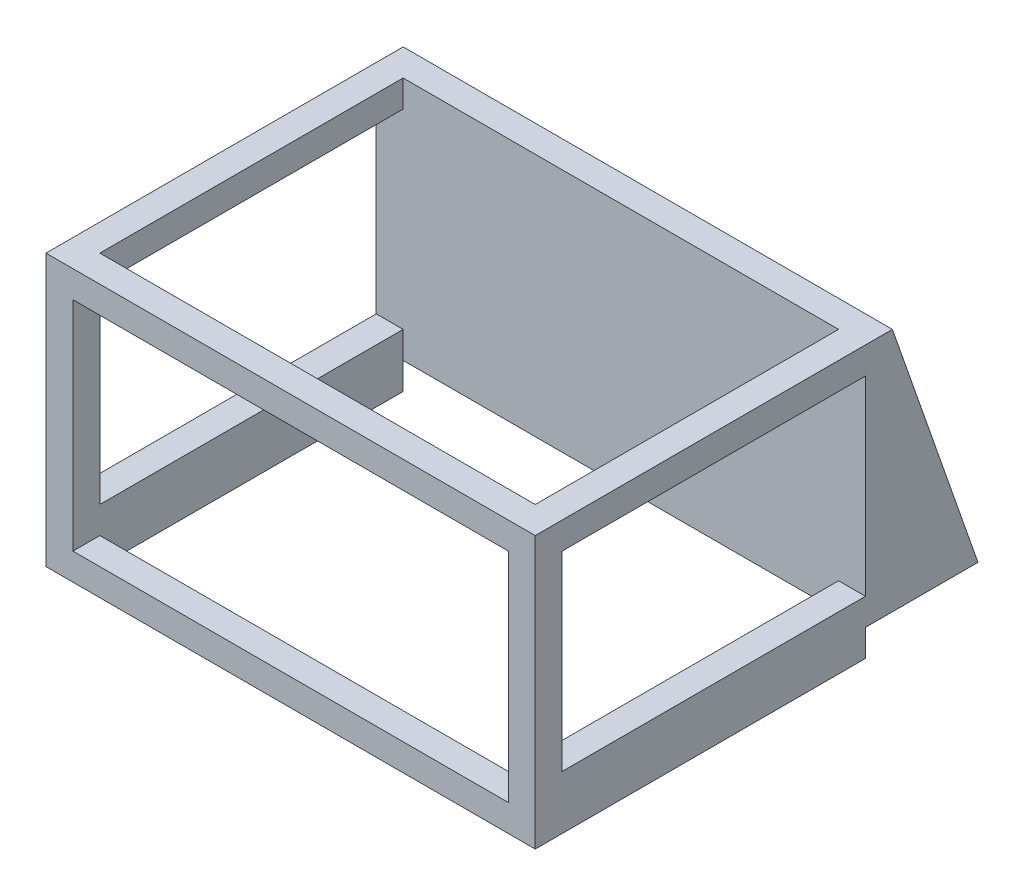
from build123d import *

# Parameters (mm, degrees)
ESQUISSE1_W             = 400
ESQUISSE1_H             = 222
BOSS_EXTRU_1_DEPTH      = 292
ESQUISSE2_W             = 356
ESQUISSE2_H             = 270
ENL_V_MAT_EXTRU_1_DEPTH = 428.684801456
ESQUISSE8_W             = 270
ESQUISSE8_H             = 156
ENL_V_MAT_EXTRU_2_DEPTH = 513.128650853
ESQUISSE9_W             = 356
ESQUISSE9_H             = 178
ENL_V_MAT_EXTRU_3_DEPTH = 389.126325339
ESQUISSE10_W            = 22
ESQUISSE10_H            = 22
ENL_V_MAT_EXTRU_4_DEPTH = 400
ESQUISSE11_W            = 22
ESQUISSE11_H            = 200
BOSS_EXTRU_2_DEPTH      = 400
BOSS_EXTRU_3_DEPTH      = 22
BOSS_EXTRU_4_DEPTH      = 22


with BuildPart() as part:
    # Esquisse1 → Boss.-Extru.1 (new body)
    with BuildSketch(Plane.XY):
        with Locations((19.923371648, -19.429118774)):
            Rectangle(ESQUISSE1_W, ESQUISSE1_H)
    extrude(amount=BOSS_EXTRU_1_DEPTH)

    # Esquisse2 → Enlèv. mat.-Extru.1 (cut, through all)
    with BuildSketch(Plane.XZ.offset(130.429118774)):
        with Locations((19.923371648, 135)):
            Rectangle(ESQUISSE2_W, ESQUISSE2_H)
    extrude(amount=-ENL_V_MAT_EXTRU_1_DEPTH, mode=Mode.SUBTRACT)

    # Esquisse8 → Enlèv. mat.-Extru.2 (cut, through all)
    with BuildSketch(Plane(origin=(219.923371648, 0, 0), x_dir=(0, 0, -1), z_dir=(1, 0, 0))):
        with Locations((-135, -8.429118774)):
            Rectangle(ESQUISSE8_W, ESQUISSE8_H)
    extrude(amount=-ENL_V_MAT_EXTRU_2_DEPTH, mode=Mode.SUBTRACT)

    # Esquisse9 → Enlèv. mat.-Extru.3 (cut, through all)
    with BuildSketch(Plane.XY.offset(292)):
        with Locations((19.923371648, -19.429118774)):
            Rectangle(ESQUISSE9_W, ESQUISSE9_H)
    extrude(amount=-ENL_V_MAT_EXTRU_3_DEPTH, mode=Mode.SUBTRACT)

    # Esquisse10 → Enlèv. mat.-Extru.4 (cut)
    with BuildSketch(Plane(origin=(219.923371648, 0, 0), x_dir=(0, 0, -1), z_dir=(1, 0, 0))):
        with Locations((-11, -119.429118774)):
            Rectangle(ESQUISSE10_W, ESQUISSE10_H)
    extrude(amount=-ENL_V_MAT_EXTRU_4_DEPTH, mode=Mode.SUBTRACT)

    # Esquisse11 → Boss.-Extru.2 (add)
    with BuildSketch(Plane(origin=(219.923371648, 0, 0), x_dir=(0, 0, -1), z_dir=(1, 0, 0))):
        with Locations((-11, -8.429118774)):
            Rectangle(ESQUISSE11_W, ESQUISSE11_H)
    extrude(amount=-BOSS_EXTRU_2_DEPTH)

    # Esquisse12 → Boss.-Extru.3 (add)
    with BuildSketch(Plane(origin=(219.923371648, 0, 0), x_dir=(0, 0, -1), z_dir=(1, 0, 0))):
        Polygon((70, -108.429118774), (0, 91.570881226), (0, -108.429118774), align=None)
    extrude(amount=-BOSS_EXTRU_3_DEPTH)

    # Esquisse13 → Boss.-Extru.4 (add)
    with BuildSketch(Plane.ZY.offset(180.076628352)):
        Polygon((0, -108.429118774), (-70, -108.429118774), (0, 91.570881226), align=None)
    extrude(amount=-BOSS_EXTRU_4_DEPTH)


solid = part.part
